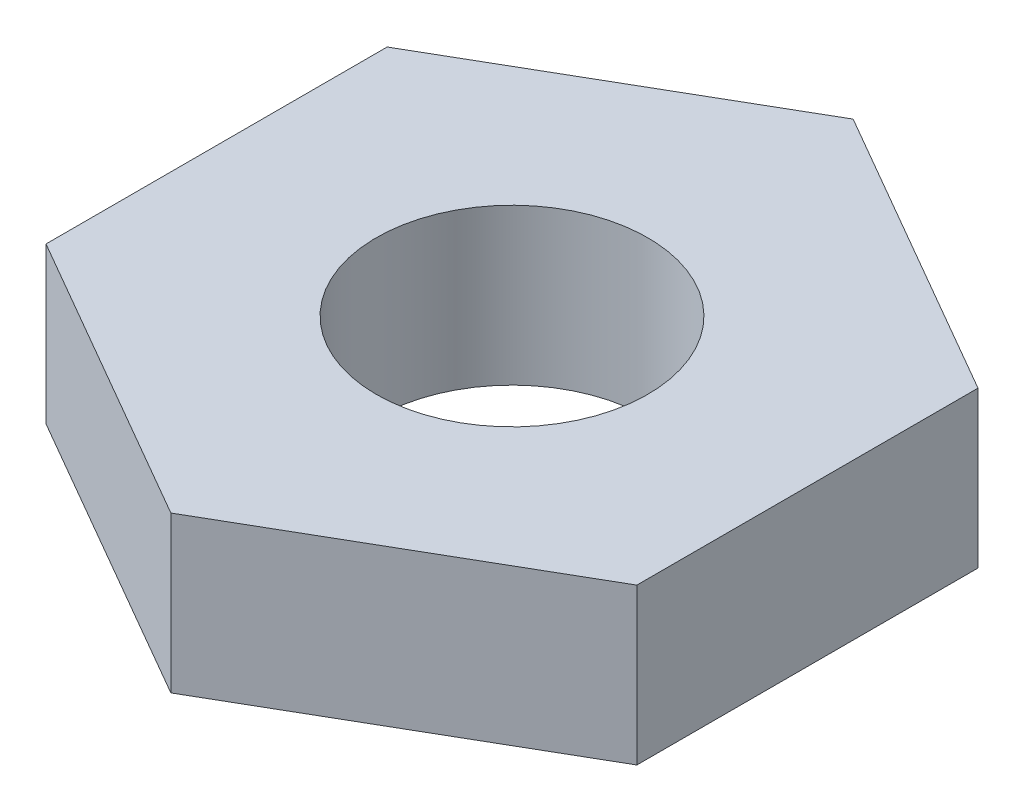
from build123d import *

# Parameters (mm, degrees)
SKETCH1_R           = 1.4605
BOSS_EXTRUDE1_DEPTH = 1.6764


with BuildPart() as part:
    # Sketch1 → Boss-Extrude1 (new body)
    with BuildSketch(Plane(origin=(0, 0, 0), x_dir=(1, 0, 0), z_dir=(0, 1, 0))):
        Polygon((-3.17857304, 1.83515), (0, 3.6703), (3.17857304, 1.83515), (3.17857304, -1.83515), (0, -3.6703), (-3.17857304, -1.83515), align=None)
        with Locations(Location((0, 0, 0), (0, 0, 270))):
            Circle(SKETCH1_R, mode=Mode.SUBTRACT)
    extrude(amount=BOSS_EXTRUDE1_DEPTH)


solid = part.part
